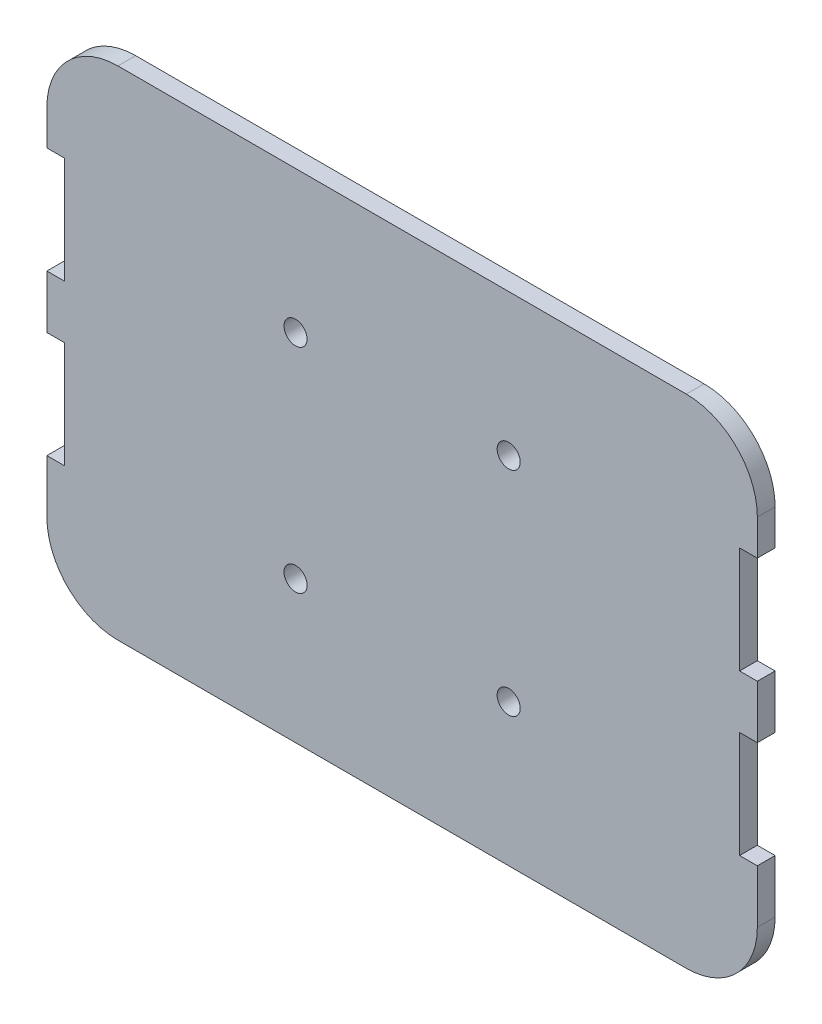
from build123d import *

# Parameters (mm, degrees)
SKETCH_1_W          = 200
SKETCH_1_H          = 140
SKETCH_1_R          = 3.25
EXTRUDE_1_DEPTH     = 5
FILLET_1_R          = 20
SKETCH_3_W          = 5
SKETCH_3_H          = 30
CUT_EXTRUDE_1_DEPTH = 39


with BuildPart() as part:
    # 草图1 → 凸台-拉伸1 (new body)
    with BuildSketch(Plane.XY):
        with Locations((0, 50)):
            Rectangle(SKETCH_1_W, SKETCH_1_H)
        with Locations((30, 80)):
            Circle(SKETCH_1_R, mode=Mode.SUBTRACT)
        with Locations(Location((30, 20, 0), (0, 0, 180))):
            Circle(SKETCH_1_R, mode=Mode.SUBTRACT)
        with Locations(Location((-30, 80, 0), (0, 0, 180))):
            Circle(SKETCH_1_R, mode=Mode.SUBTRACT)
        with Locations((-30, 20)):
            Circle(SKETCH_1_R, mode=Mode.SUBTRACT)
    extrude(amount=EXTRUDE_1_DEPTH)

    # 圆角1
    fillet_1_edges = [part.edges().sort_by_distance(p)[0] for p in [
        (-100, 120, 2.5),
        (-100, -20, 2.5),
        (100, -20, 2.5),
        (100, 120, 2.5),
    ]]
    fillet(fillet_1_edges, radius=FILLET_1_R)

    # 草图3 → 切除-拉伸1 (cut)
    with BuildSketch(Plane.XY.offset(5)):
        with Locations((97.5, 75)):
            Rectangle(SKETCH_3_W, SKETCH_3_H)
        with Locations((97.5, 30)):
            Rectangle(SKETCH_3_W, SKETCH_3_H)
        with Locations((-97.5, 30)):
            Rectangle(SKETCH_3_W, SKETCH_3_H)
        with Locations((-97.5, 75)):
            Rectangle(SKETCH_3_W, SKETCH_3_H)
    extrude(amount=-CUT_EXTRUDE_1_DEPTH, mode=Mode.SUBTRACT)


solid = part.part
